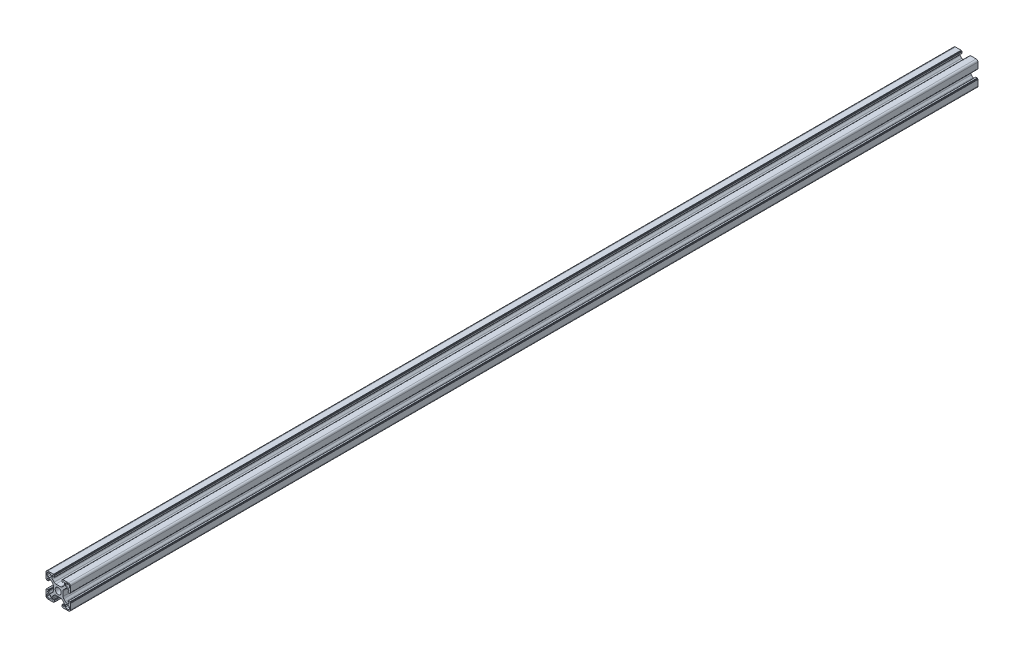
from build123d import *

# Parameters (mm, degrees)
EXTRUDE_1_DEPTH = 745


with BuildPart() as part:
    # Эскиз1 → Бобышка-Вытянуть1 (new body)
    with BuildSketch(Plane.XY):
        with BuildLine():
            Line((-18.466980253, 43.461877394), (-16.568199584, 43.461877394))
            ThreePointArc((-16.568199584, 43.461877394), (-15.80283272, 43.614118329), (-15.153986022, 44.047663832))
            Line((-15.153986022, 44.047663832), (-13.852766691, 45.348883163))
            ThreePointArc((-13.852766691, 45.348883163), (-13.419221188, 45.99772986), (-13.266980253, 46.763096725))
            Line((-13.266980253, 46.763096725), (-13.266980253, 47.661877394))
            ThreePointArc((-13.266980253, 47.661877394), (-13.413426863, 48.015430785), (-13.766980253, 48.161877394))
            Line((-13.766980253, 48.161877394), (-13.869873472, 48.161877394))
            ThreePointArc((-13.869873472, 48.161877394), (-14.061215188, 48.123817161), (-14.223426863, 48.015430785))
            Line((-14.223426863, 48.015430785), (-14.703756949, 47.535100699))
            ThreePointArc((-14.703756949, 47.535100699), (-14.784862786, 47.480907511), (-14.880533644, 47.461877394))
            Line((-14.880533644, 47.461877394), (-15.166980253, 47.461877394))
            ThreePointArc((-15.166980253, 47.461877394), (-15.343756949, 47.535100699), (-15.416980253, 47.711877394))
            Line((-15.416980253, 47.711877394), (-15.416980253, 48.860948215))
            ThreePointArc((-15.416980253, 48.860948215), (-15.373046271, 48.967014232), (-15.266980253, 49.010948215))
            Line((-15.266980253, 49.010948215), (-14.766980253, 49.010948215))
            Line((-14.766980253, 49.010948215), (-14.766980253, 49.311877394))
            ThreePointArc((-14.766980253, 49.311877394), (-14.723046271, 49.417943411), (-14.616980253, 49.461877394))
            Line((-14.616980253, 49.461877394), (-9.966980253, 49.461877394))
            ThreePointArc((-9.966980253, 49.461877394), (-8.906320082, 49.022537566), (-8.466980253, 47.961877394))
            Line((-8.466980253, 47.961877394), (-8.466980253, 43.311877394))
            ThreePointArc((-8.466980253, 43.311877394), (-8.510914236, 43.205811377), (-8.616980253, 43.161877394))
            Line((-8.616980253, 43.161877394), (-8.917909433, 43.161877394))
            Line((-8.917909433, 43.161877394), (-8.917909433, 42.661877394))
            ThreePointArc((-8.917909433, 42.661877394), (-8.961843416, 42.555811377), (-9.067909433, 42.511877394))
            Line((-9.067909433, 42.511877394), (-10.216980253, 42.511877394))
            ThreePointArc((-10.216980253, 42.511877394), (-10.393756949, 42.585100699), (-10.466980253, 42.761877394))
            Line((-10.466980253, 42.761877394), (-10.466980253, 43.048324004))
            ThreePointArc((-10.466980253, 43.048324004), (-10.447950137, 43.143994862), (-10.393756949, 43.225100699))
            Line((-10.393756949, 43.225100699), (-9.913426863, 43.705430785))
            ThreePointArc((-9.913426863, 43.705430785), (-9.805040487, 43.867642459), (-9.766980253, 44.058984175))
            Line((-9.766980253, 44.058984175), (-9.766980253, 44.161877394))
            ThreePointArc((-9.766980253, 44.161877394), (-9.913426863, 44.515430785), (-10.266980253, 44.661877394))
            Line((-10.266980253, 44.661877394), (-11.165760923, 44.661877394))
            ThreePointArc((-11.165760923, 44.661877394), (-11.931127787, 44.509636459), (-12.579974485, 44.076090957))
            Line((-12.579974485, 44.076090957), (-13.881193816, 42.774871626))
            ThreePointArc((-13.881193816, 42.774871626), (-14.314739319, 42.126024928), (-14.466980253, 41.360658063))
            Line((-14.466980253, 41.360658063), (-14.466980253, 39.461877394))
            Line((-14.466980253, 39.461877394), (-14.466980253, 37.563096725))
            ThreePointArc((-14.466980253, 37.563096725), (-14.314739319, 36.79772986), (-13.881193816, 36.148883163))
            Line((-13.881193816, 36.148883163), (-12.579974485, 34.847663832))
            ThreePointArc((-12.579974485, 34.847663832), (-11.931127787, 34.414118329), (-11.165760923, 34.261877394))
            Line((-11.165760923, 34.261877394), (-10.266980253, 34.261877394))
            ThreePointArc((-10.266980253, 34.261877394), (-9.913426863, 34.408324004), (-9.766980253, 34.761877394))
            Line((-9.766980253, 34.761877394), (-9.766980253, 34.864770613))
            ThreePointArc((-9.766980253, 34.864770613), (-9.805040487, 35.056112329), (-9.913426863, 35.218324004))
            Line((-9.913426863, 35.218324004), (-10.393756949, 35.69865409))
            ThreePointArc((-10.393756949, 35.69865409), (-10.447950137, 35.779759927), (-10.466980253, 35.875430785))
            Line((-10.466980253, 35.875430785), (-10.466980253, 36.161877394))
            ThreePointArc((-10.466980253, 36.161877394), (-10.393756949, 36.33865409), (-10.216980253, 36.411877394))
            Line((-10.216980253, 36.411877394), (-9.067909433, 36.411877394))
            ThreePointArc((-9.067909433, 36.411877394), (-8.961843416, 36.367943411), (-8.917909433, 36.261877394))
            Line((-8.917909433, 36.261877394), (-8.917909433, 35.761877394))
            Line((-8.917909433, 35.761877394), (-8.616980253, 35.761877394))
            ThreePointArc((-8.616980253, 35.761877394), (-8.510914236, 35.717943411), (-8.466980253, 35.611877394))
            Line((-8.466980253, 35.611877394), (-8.466980253, 30.961877394))
            ThreePointArc((-8.466980253, 30.961877394), (-8.906320082, 29.901217222), (-9.966980253, 29.461877394))
            Line((-9.966980253, 29.461877394), (-14.616980253, 29.461877394))
            ThreePointArc((-14.616980253, 29.461877394), (-14.723046271, 29.505811377), (-14.766980253, 29.611877394))
            Line((-14.766980253, 29.611877394), (-14.766980253, 29.912806574))
            Line((-14.766980253, 29.912806574), (-15.266980253, 29.912806574))
            ThreePointArc((-15.266980253, 29.912806574), (-15.373046271, 29.956740557), (-15.416980253, 30.062806574))
            Line((-15.416980253, 30.062806574), (-15.416980253, 31.211877394))
            ThreePointArc((-15.416980253, 31.211877394), (-15.343756949, 31.38865409), (-15.166980253, 31.461877394))
            Line((-15.166980253, 31.461877394), (-14.880533644, 31.461877394))
            ThreePointArc((-14.880533644, 31.461877394), (-14.784862786, 31.442847277), (-14.703756949, 31.38865409))
            Line((-14.703756949, 31.38865409), (-14.223426863, 30.908324004))
            ThreePointArc((-14.223426863, 30.908324004), (-14.061215188, 30.799937628), (-13.869873472, 30.761877394))
            Line((-13.869873472, 30.761877394), (-13.766980253, 30.761877394))
            ThreePointArc((-13.766980253, 30.761877394), (-13.413426863, 30.908324004), (-13.266980253, 31.261877394))
            Line((-13.266980253, 31.261877394), (-13.266980253, 32.160658063))
            ThreePointArc((-13.266980253, 32.160658063), (-13.419221188, 32.926024928), (-13.852766691, 33.574871626))
            Line((-13.852766691, 33.574871626), (-15.153986022, 34.876090957))
            ThreePointArc((-15.153986022, 34.876090957), (-15.80283272, 35.309636459), (-16.568199584, 35.461877394))
            Line((-16.568199584, 35.461877394), (-18.466980253, 35.461877394))
            Line((-18.466980253, 35.461877394), (-20.365760923, 35.461877394))
            ThreePointArc((-20.365760923, 35.461877394), (-21.131127787, 35.309636459), (-21.779974485, 34.876090957))
            Line((-21.779974485, 34.876090957), (-23.081193816, 33.574871626))
            ThreePointArc((-23.081193816, 33.574871626), (-23.514739319, 32.926024928), (-23.666980253, 32.160658063))
            Line((-23.666980253, 32.160658063), (-23.666980253, 31.261877394))
            ThreePointArc((-23.666980253, 31.261877394), (-23.520533644, 30.908324004), (-23.166980253, 30.761877394))
            Line((-23.166980253, 30.761877394), (-23.064087035, 30.761877394))
            ThreePointArc((-23.064087035, 30.761877394), (-22.872745319, 30.799937628), (-22.710533644, 30.908324004))
            Line((-22.710533644, 30.908324004), (-22.230203558, 31.38865409))
            ThreePointArc((-22.230203558, 31.38865409), (-22.149097721, 31.442847277), (-22.053426863, 31.461877394))
            Line((-22.053426863, 31.461877394), (-21.766980253, 31.461877394))
            ThreePointArc((-21.766980253, 31.461877394), (-21.590203558, 31.38865409), (-21.516980253, 31.211877394))
            Line((-21.516980253, 31.211877394), (-21.516980253, 30.062806574))
            ThreePointArc((-21.516980253, 30.062806574), (-21.560914236, 29.956740557), (-21.666980253, 29.912806574))
            Line((-21.666980253, 29.912806574), (-22.166980253, 29.912806574))
            Line((-22.166980253, 29.912806574), (-22.166980253, 29.611877394))
            ThreePointArc((-22.166980253, 29.611877394), (-22.210914236, 29.505811377), (-22.316980253, 29.461877394))
            Line((-22.316980253, 29.461877394), (-26.966980253, 29.461877394))
            ThreePointArc((-26.966980253, 29.461877394), (-28.027640425, 29.901217222), (-28.466980253, 30.961877394))
            Line((-28.466980253, 30.961877394), (-28.466980253, 35.611877394))
            ThreePointArc((-28.466980253, 35.611877394), (-28.423046271, 35.717943411), (-28.316980253, 35.761877394))
            Line((-28.316980253, 35.761877394), (-28.016051074, 35.761877394))
            Line((-28.016051074, 35.761877394), (-28.016051074, 36.261877394))
            ThreePointArc((-28.016051074, 36.261877394), (-27.972117091, 36.367943411), (-27.866051074, 36.411877394))
            Line((-27.866051074, 36.411877394), (-26.716980253, 36.411877394))
            ThreePointArc((-26.716980253, 36.411877394), (-26.540203558, 36.33865409), (-26.466980253, 36.161877394))
            Line((-26.466980253, 36.161877394), (-26.466980253, 35.875430785))
            ThreePointArc((-26.466980253, 35.875430785), (-26.48601037, 35.779759927), (-26.540203558, 35.69865409))
            Line((-26.540203558, 35.69865409), (-27.020533644, 35.218324004))
            ThreePointArc((-27.020533644, 35.218324004), (-27.12892002, 35.056112329), (-27.166980253, 34.864770613))
            Line((-27.166980253, 34.864770613), (-27.166980253, 34.761877394))
            ThreePointArc((-27.166980253, 34.761877394), (-27.020533644, 34.408324004), (-26.666980253, 34.261877394))
            Line((-26.666980253, 34.261877394), (-25.768199584, 34.261877394))
            ThreePointArc((-25.768199584, 34.261877394), (-25.00283272, 34.414118329), (-24.353986022, 34.847663832))
            Line((-24.353986022, 34.847663832), (-23.052766691, 36.148883163))
            ThreePointArc((-23.052766691, 36.148883163), (-22.619221188, 36.79772986), (-22.466980253, 37.563096725))
            Line((-22.466980253, 37.563096725), (-22.466980253, 39.461877394))
            Line((-22.466980253, 39.461877394), (-22.466980253, 41.360658063))
            ThreePointArc((-22.466980253, 41.360658063), (-22.619221188, 42.126024928), (-23.052766691, 42.774871626))
            Line((-23.052766691, 42.774871626), (-24.353986022, 44.076090957))
            ThreePointArc((-24.353986022, 44.076090957), (-25.00283272, 44.509636459), (-25.768199584, 44.661877394))
            Line((-25.768199584, 44.661877394), (-26.666980253, 44.661877394))
            ThreePointArc((-26.666980253, 44.661877394), (-27.020533644, 44.515430785), (-27.166980253, 44.161877394))
            Line((-27.166980253, 44.161877394), (-27.166980253, 44.058984175))
            ThreePointArc((-27.166980253, 44.058984175), (-27.12892002, 43.867642459), (-27.020533644, 43.705430785))
            Line((-27.020533644, 43.705430785), (-26.540203558, 43.225100699))
            ThreePointArc((-26.540203558, 43.225100699), (-26.48601037, 43.143994862), (-26.466980253, 43.048324004))
            Line((-26.466980253, 43.048324004), (-26.466980253, 42.761877394))
            ThreePointArc((-26.466980253, 42.761877394), (-26.540203558, 42.585100699), (-26.716980253, 42.511877394))
            Line((-26.716980253, 42.511877394), (-27.866051074, 42.511877394))
            ThreePointArc((-27.866051074, 42.511877394), (-27.972117091, 42.555811377), (-28.016051074, 42.661877394))
            Line((-28.016051074, 42.661877394), (-28.016051074, 43.161877394))
            Line((-28.016051074, 43.161877394), (-28.316980253, 43.161877394))
            ThreePointArc((-28.316980253, 43.161877394), (-28.423046271, 43.205811377), (-28.466980253, 43.311877394))
            Line((-28.466980253, 43.311877394), (-28.466980253, 47.961877394))
            ThreePointArc((-28.466980253, 47.961877394), (-28.027640425, 49.022537566), (-26.966980253, 49.461877394))
            Line((-26.966980253, 49.461877394), (-22.316980253, 49.461877394))
            ThreePointArc((-22.316980253, 49.461877394), (-22.210914236, 49.417943411), (-22.166980253, 49.311877394))
            Line((-22.166980253, 49.311877394), (-22.166980253, 49.010948215))
            Line((-22.166980253, 49.010948215), (-21.666980253, 49.010948215))
            ThreePointArc((-21.666980253, 49.010948215), (-21.560914236, 48.967014232), (-21.516980253, 48.860948215))
            Line((-21.516980253, 48.860948215), (-21.516980253, 47.711877394))
            ThreePointArc((-21.516980253, 47.711877394), (-21.590203558, 47.535100699), (-21.766980253, 47.461877394))
            Line((-21.766980253, 47.461877394), (-22.053426863, 47.461877394))
            ThreePointArc((-22.053426863, 47.461877394), (-22.149097721, 47.480907511), (-22.230203558, 47.535100699))
            Line((-22.230203558, 47.535100699), (-22.710533644, 48.015430785))
            ThreePointArc((-22.710533644, 48.015430785), (-22.872745319, 48.123817161), (-23.064087035, 48.161877394))
            Line((-23.064087035, 48.161877394), (-23.166980253, 48.161877394))
            ThreePointArc((-23.166980253, 48.161877394), (-23.520533644, 48.015430785), (-23.666980253, 47.661877394))
            Line((-23.666980253, 47.661877394), (-23.666980253, 46.763096725))
            ThreePointArc((-23.666980253, 46.763096725), (-23.514739319, 45.99772986), (-23.081193816, 45.348883163))
            Line((-23.081193816, 45.348883163), (-21.779974485, 44.047663832))
            ThreePointArc((-21.779974485, 44.047663832), (-21.131127787, 43.614118329), (-20.365760923, 43.461877394))
            Line((-20.365760923, 43.461877394), (-18.466980253, 43.461877394))
        make_face()
        with BuildLine():
            Line((-11.566980253, 45.561877394), (-10.166980253, 45.561877394))
            ThreePointArc((-10.166980253, 45.561877394), (-9.601294829, 45.796191969), (-9.366980253, 46.361877394))
            Line((-9.366980253, 46.361877394), (-9.366980253, 47.761877394))
            ThreePointArc((-9.366980253, 47.761877394), (-9.601294829, 48.327562819), (-10.166980253, 48.561877394))
            Line((-10.166980253, 48.561877394), (-11.566980253, 48.561877394))
            ThreePointArc((-11.566980253, 48.561877394), (-12.132665678, 48.327562819), (-12.366980253, 47.761877394))
            Line((-12.366980253, 47.761877394), (-12.366980253, 46.361877394))
            ThreePointArc((-12.366980253, 46.361877394), (-12.132665678, 45.796191969), (-11.566980253, 45.561877394))
        make_face(mode=Mode.SUBTRACT)
        with BuildLine():
            Line((-12.366980253, 32.561877394), (-12.366980253, 31.161877394))
            ThreePointArc((-12.366980253, 31.161877394), (-12.132665678, 30.596191969), (-11.566980253, 30.361877394))
            Line((-11.566980253, 30.361877394), (-10.166980253, 30.361877394))
            ThreePointArc((-10.166980253, 30.361877394), (-9.601294829, 30.596191969), (-9.366980253, 31.161877394))
            Line((-9.366980253, 31.161877394), (-9.366980253, 32.561877394))
            ThreePointArc((-9.366980253, 32.561877394), (-9.601294829, 33.127562819), (-10.166980253, 33.361877394))
            Line((-10.166980253, 33.361877394), (-11.566980253, 33.361877394))
            ThreePointArc((-11.566980253, 33.361877394), (-12.132665678, 33.127562819), (-12.366980253, 32.561877394))
        make_face(mode=Mode.SUBTRACT)
        with BuildLine():
            Line((-25.366980253, 33.361877394), (-26.766980253, 33.361877394))
            ThreePointArc((-26.766980253, 33.361877394), (-27.332665678, 33.127562819), (-27.566980253, 32.561877394))
            Line((-27.566980253, 32.561877394), (-27.566980253, 31.161877394))
            ThreePointArc((-27.566980253, 31.161877394), (-27.332665678, 30.596191969), (-26.766980253, 30.361877394))
            Line((-26.766980253, 30.361877394), (-25.366980253, 30.361877394))
            ThreePointArc((-25.366980253, 30.361877394), (-24.801294829, 30.596191969), (-24.566980253, 31.161877394))
            Line((-24.566980253, 31.161877394), (-24.566980253, 32.561877394))
            ThreePointArc((-24.566980253, 32.561877394), (-24.801294829, 33.127562819), (-25.366980253, 33.361877394))
        make_face(mode=Mode.SUBTRACT)
        with BuildLine():
            Line((-24.566980253, 46.361877394), (-24.566980253, 47.761877394))
            ThreePointArc((-24.566980253, 47.761877394), (-24.801294829, 48.327562819), (-25.366980253, 48.561877394))
            Line((-25.366980253, 48.561877394), (-26.766980253, 48.561877394))
            ThreePointArc((-26.766980253, 48.561877394), (-27.332665678, 48.327562819), (-27.566980253, 47.761877394))
            Line((-27.566980253, 47.761877394), (-27.566980253, 46.361877394))
            ThreePointArc((-27.566980253, 46.361877394), (-27.332665678, 45.796191969), (-26.766980253, 45.561877394))
            Line((-26.766980253, 45.561877394), (-25.366980253, 45.561877394))
            ThreePointArc((-25.366980253, 45.561877394), (-24.801294829, 45.796191969), (-24.566980253, 46.361877394))
        make_face(mode=Mode.SUBTRACT)
        with BuildLine():
            ThreePointArc((-15.966980253, 39.461877394), (-16.699213301, 41.229644347), (-18.466980253, 41.961877394))
            ThreePointArc((-18.466980253, 41.961877394), (-20.234747206, 41.229644347), (-20.966980253, 39.461877394))
            ThreePointArc((-20.966980253, 39.461877394), (-20.234747206, 37.694110441), (-18.466980253, 36.961877394))
            ThreePointArc((-18.466980253, 36.961877394), (-16.699213301, 37.694110441), (-15.966980253, 39.461877394))
        make_face(mode=Mode.SUBTRACT)
    extrude(amount=EXTRUDE_1_DEPTH)


solid = part.part
